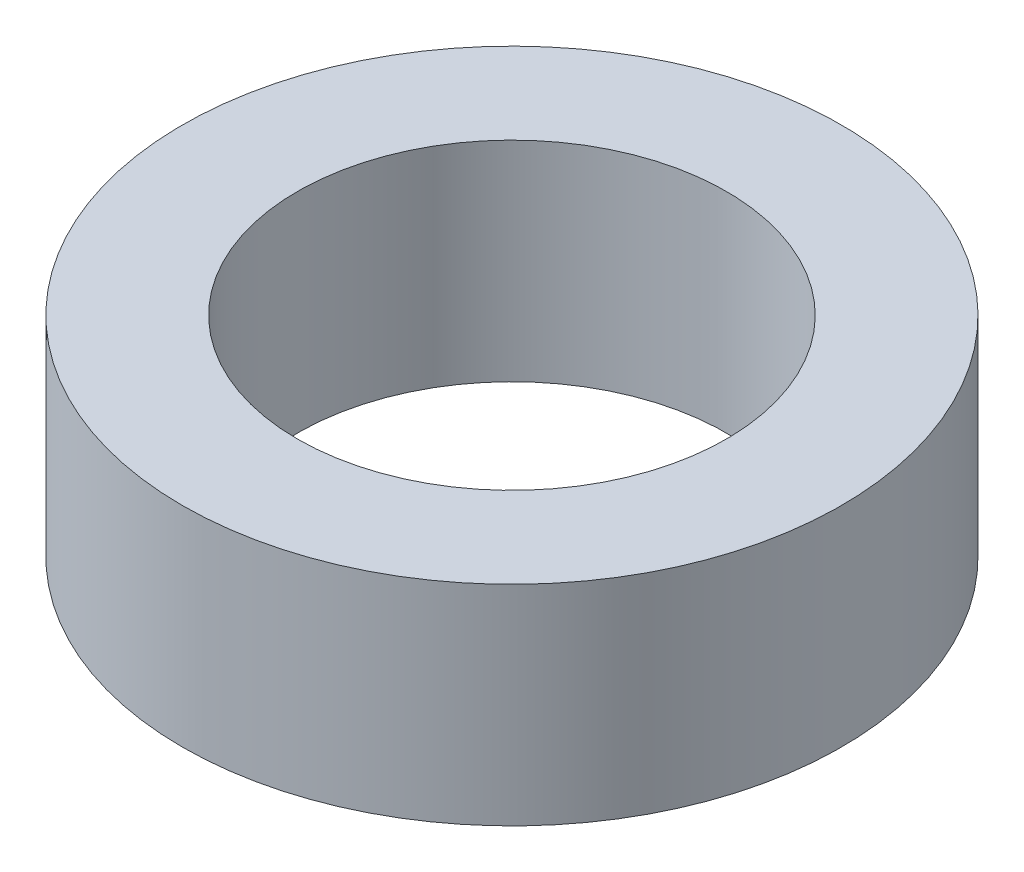
from build123d import *

# Parameters (mm, degrees)
SKETCH1_R           = 3.15
SKETCH1_R_2         = 2.05
BOSS_EXTRUDE1_DEPTH = 2


with BuildPart() as part:
    # Sketch1 → Boss-Extrude1 (new body)
    with BuildSketch(Plane(origin=(0, 0, 0), x_dir=(1, 0, 0), z_dir=(0, 1, 0))):
        with Locations(Location((0, 0, 0), (0, 0, 270))):
            Circle(SKETCH1_R)
        with Locations(Location((0, 0, 0), (0, 0, 270))):
            Circle(SKETCH1_R_2, mode=Mode.SUBTRACT)
    extrude(amount=BOSS_EXTRUDE1_DEPTH)


solid = part.part
